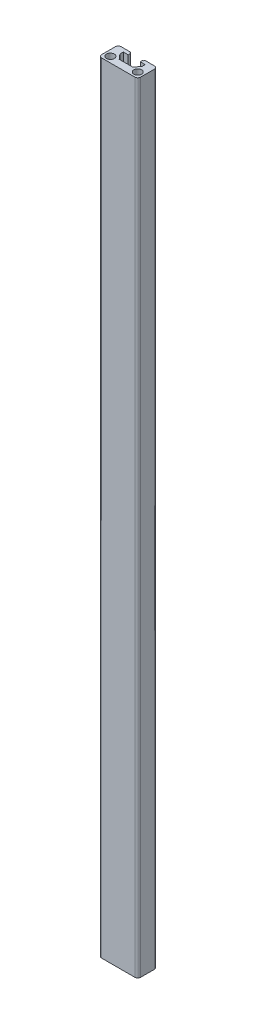
from build123d import *

# Parameters (mm, degrees)
SKETCH_1_R      = 2
EXTRUDE_1_DEPTH = 400
FILLET_1_R      = 1.5


with BuildPart() as part:
    # 草图1 → 凸台-拉伸1 (new body)
    with BuildSketch(Plane(origin=(0, 0, 0), x_dir=(1, 0, 0), z_dir=(0, 1, 0))):
        Polygon((0, 0), (20, 0), (20, 10), (13.65, 10), (13.65, 9.510427602), (13.1, 9.510427602), (13.1, 8.2), (15.6, 8.2), (15.6, 6.447507136), (13.412706863, 3.9), (6.587293137, 3.9), (4.4, 6.447507136), (4.4, 8.2), (6.9, 8.2), (6.9, 9.510427602), (6.35, 9.510427602), (6.35, 10), (0, 10), align=None)
        with Locations(Location((3, 3, 0), (0, 0, 270))):
            Circle(SKETCH_1_R, mode=Mode.SUBTRACT)
        with Locations(Location((17, 3, 0), (0, 0, 270))):
            Circle(SKETCH_1_R, mode=Mode.SUBTRACT)
    extrude(amount=EXTRUDE_1_DEPTH)

    # 圆角1
    fillet_1_edges = [part.edges().sort_by_distance(p)[0] for p in [
        (0, 200, -10),
        (20, 200, -10),
        (20, 200, 0),
        (0, 200, 0),
    ]]
    fillet(fillet_1_edges, radius=FILLET_1_R)


solid = part.part
